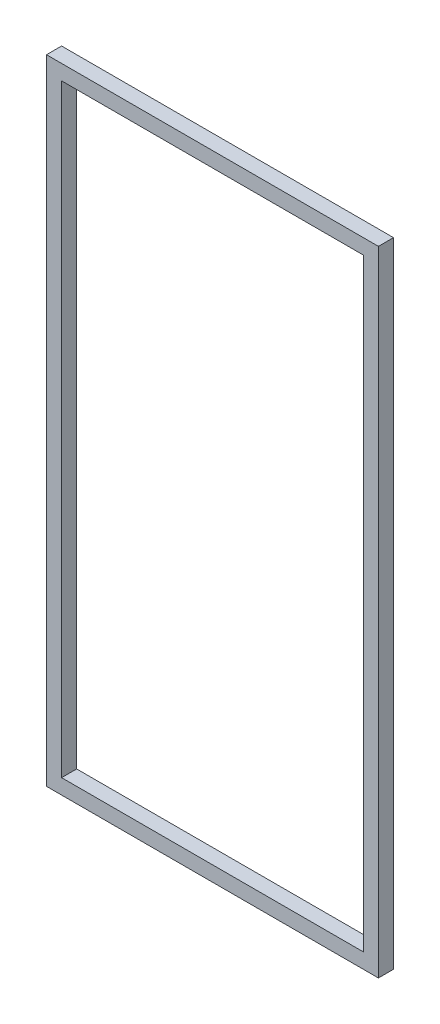
from build123d import *

# Parameters (mm, degrees)
SKETCH1_W           = 1100
SKETCH1_H           = 2100
BOSS_EXTRUDE1_DEPTH = 50
SKETCH2_W           = 1000
SKETCH2_H           = 2000
CUT_EXTRUDE1_DEPTH  = 50


with BuildPart() as part:
    # Sketch1 → Boss-Extrude1 (new body)
    with BuildSketch(Plane.XY):
        Rectangle(SKETCH1_W, SKETCH1_H)
    extrude(amount=BOSS_EXTRUDE1_DEPTH)

    # Sketch2 → Cut-Extrude1 (cut)
    with BuildSketch(Plane.XY.offset(50)):
        Rectangle(SKETCH2_W, SKETCH2_H)
    extrude(amount=-CUT_EXTRUDE1_DEPTH, mode=Mode.SUBTRACT)


solid = part.part
